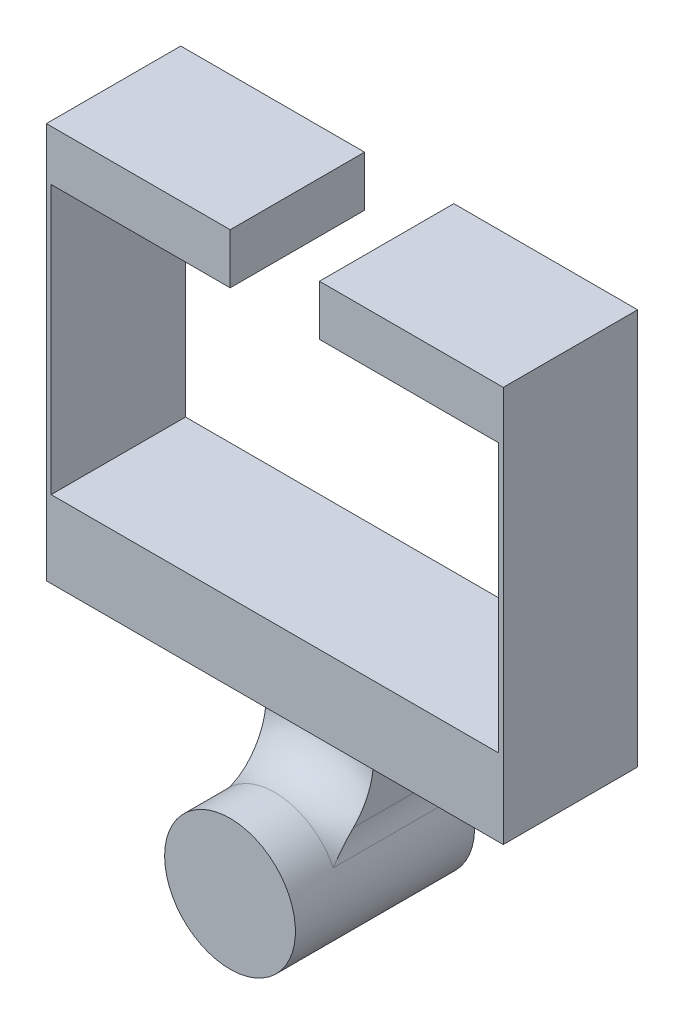
from build123d import *

# Parameters (mm, degrees)
SKETCH4_W           = 64.77
SKETCH4_H           = 56.134
BOSS_EXTRUDE1_DEPTH = 19.05
CUT_EXTRUDE1_DEPTH  = 115.855093202
BOSS_EXTRUDE2_DEPTH = 19.05
SKETCH7_R           = 9.271
BOSS_EXTRUDE3_DEPTH = 25.4
FILLET1_R           = 6.35


with BuildPart() as part:
    # Sketch4 → Boss-Extrude1 (new body)
    with BuildSketch(Plane.XY):
        with Locations((-42.617275879, 56.806132071)):
            Rectangle(SKETCH4_W, SKETCH4_H)
    extrude(amount=BOSS_EXTRUDE1_DEPTH)

    # Sketch5 → Cut-Extrude1 (cut, through all)
    with BuildSketch(Plane.XY.offset(19.05)):
        Polygon((-74.321555879, 39.661132071), (-10.912995879, 39.661132071), (-10.912995879, 77.735732071), (-36.292675879, 77.735732071), (-36.292675879, 84.873132071), (-48.941875879, 84.873132071), (-48.941875879, 77.735732071), (-74.321555879, 77.735732071), align=None)
    extrude(amount=-CUT_EXTRUDE1_DEPTH, mode=Mode.SUBTRACT)

    # Sketch6 → Boss-Extrude2 (add)
    with BuildSketch(Plane.XZ.offset(-28.739132071)):
        Polygon((-42.617275879, 0), (-34.997275879, 0), (-34.997275879, 12.7), (-50.237275879, 12.7), (-50.237275879, 0), align=None)
    extrude(amount=BOSS_EXTRUDE2_DEPTH)

    # Sketch7 → Boss-Extrude3 (add)
    with BuildSketch(Plane(origin=(0, 0, 0), x_dir=(-1, 0, 0), z_dir=(0, 0, -1))):
        with Locations((42.617275879, 9.689132071)):
            Circle(SKETCH7_R)
    extrude(amount=-BOSS_EXTRUDE3_DEPTH)

    # Fillet1
    fillet1_edges = [part.edges().sort_by_distance(p)[0] for p in [
        (-50.237275879, 14.969950284, 6.35),
        (-42.617275879, 18.960132071, 12.7),
        (-34.997275879, 14.969950284, 6.35),
    ]]
    fillet(fillet1_edges, radius=FILLET1_R)


solid = part.part
